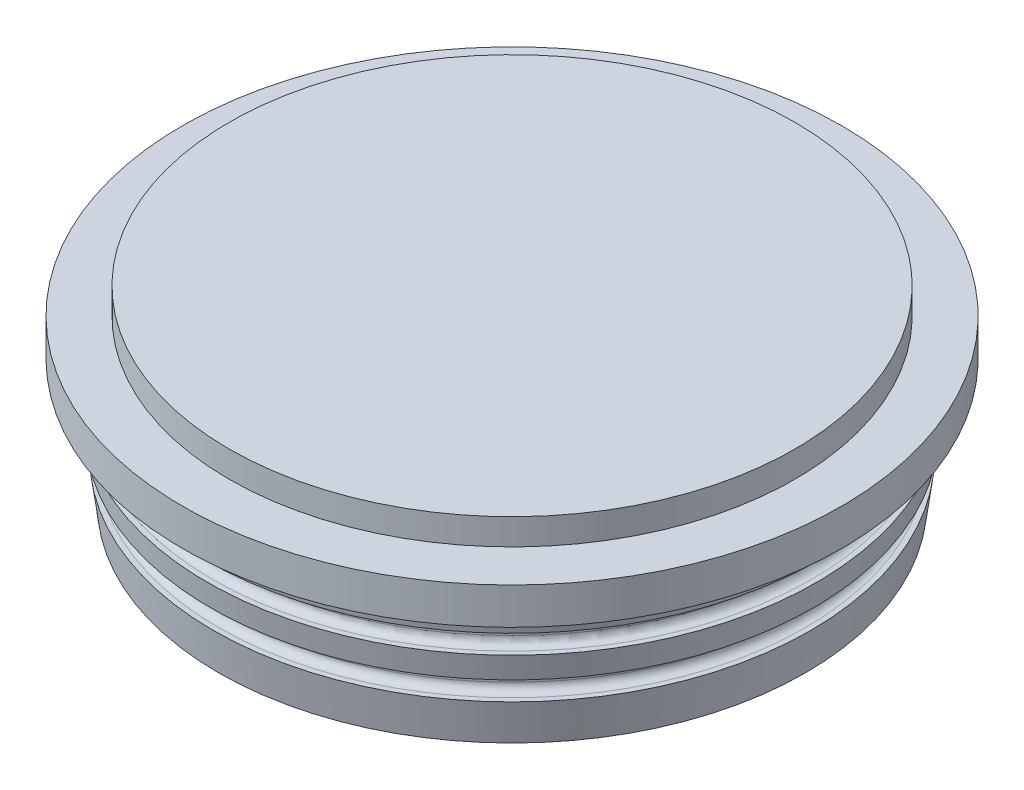
from build123d import *

# Parameters (mm, degrees)
CONG_1_R = 1.5
CONG_2_R = 10


with BuildPart() as part:
    # Esquisse1 → Révolution1 (revolve)
    with BuildSketch(Plane.XY, mode=Mode.PRIVATE) as r_volution1_sk:
        Polygon((59.159659942, -7), (62.9, -7), (62.9, 0), (54, 0), (54, 5), (0, 5), (0, 0), (0, -6.5), (47, -6.5), (47, -31), (56, -31), (56.987393732, -23.5), (54.514003722, -23.5), (54.514003722, -19.5), (57.514003722, -19.5), (58.106439961, -15), (55.633049952, -15), (55.633049952, -11), (58.633049952, -11), align=None)
    revolve(r_volution1_sk.sketch.rotate(Axis((0, 0, 0), (0, 1, 0)), 90), axis=Axis((0, 0, 0), (0, 1, 0)))

    # Congé1
    cong_1_edges = [part.edges().sort_by_distance(p)[0] for p in [
        (0, -11, 55.633049952),
        (0, -15, 55.633049952),
        (0, -19.5, 54.514003722),
        (0, -23.5, 54.514003722),
    ]]
    fillet(cong_1_edges, radius=CONG_1_R)

    # Congé2
    cong_2_edges = [part.edges().sort_by_distance(p)[0] for p in [
        (0, -6.5, 47),
    ]]
    fillet(cong_2_edges, radius=CONG_2_R)


solid = part.part
